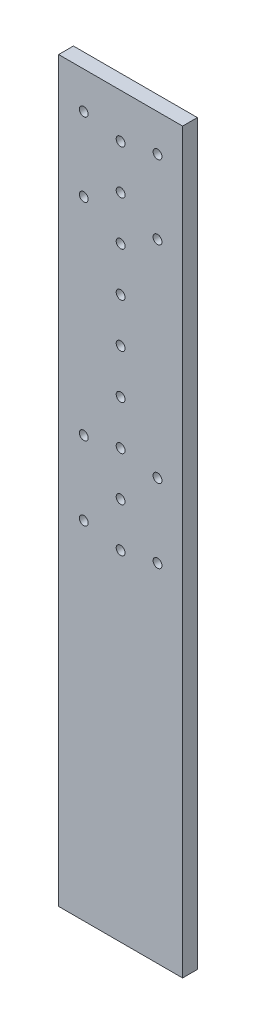
from build123d import *

# Parameters (mm, degrees)
SKETCH1_W           = 42
SKETCH1_H           = 250
BOSS_EXTRUDE1_DEPTH = 5
SKETCH2_R           = 1.5
CUT_EXTRUDE1_DEPTH  = 254.552755852


with BuildPart() as part:
    # Sketch1 → Boss-Extrude1 (new body)
    with BuildSketch(Plane.XY):
        with Locations((21, 125)):
            Rectangle(SKETCH1_W, SKETCH1_H)
    extrude(amount=BOSS_EXTRUDE1_DEPTH)

    # Sketch2 → Cut-Extrude1 (cut, through all)
    with BuildSketch(Plane.XY.offset(5)):
        with Locations((21, 235)):
            Circle(SKETCH2_R)
        with Locations((21, 220)):
            Circle(SKETCH2_R)
        with Locations((21, 205)):
            Circle(SKETCH2_R)
        with Locations((21, 190)):
            Circle(SKETCH2_R)
        with Locations((21, 175)):
            Circle(SKETCH2_R)
        with Locations((21, 160)):
            Circle(SKETCH2_R)
        with Locations((21, 145)):
            Circle(SKETCH2_R)
        with Locations((21, 130)):
            Circle(SKETCH2_R)
        with Locations((21, 115)):
            Circle(SKETCH2_R)
        with Locations((8.5, 237.5)):
            Circle(SKETCH2_R)
        with Locations((33.5, 237.5)):
            Circle(SKETCH2_R)
        with Locations((33.5, 212.5)):
            Circle(SKETCH2_R)
        with Locations((8.5, 212.5)):
            Circle(SKETCH2_R)
        with Locations((8.5, 142.5)):
            Circle(SKETCH2_R)
        with Locations((33.5, 142.5)):
            Circle(SKETCH2_R)
        with Locations((33.5, 117.5)):
            Circle(SKETCH2_R)
        with Locations((8.5, 117.5)):
            Circle(SKETCH2_R)
    extrude(amount=-CUT_EXTRUDE1_DEPTH, mode=Mode.SUBTRACT)


solid = part.part
